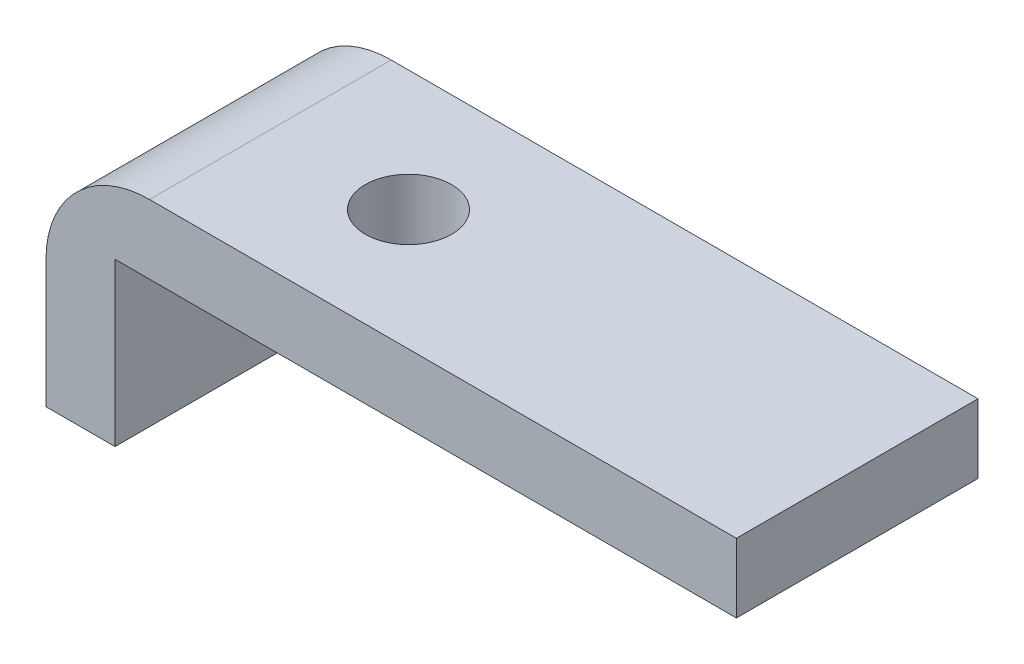
from build123d import *

# Parameters (mm, degrees)
EXTRUDE_1_DEPTH   = 3.5
HOLE_WIZARD_M31_D = 2.5


with BuildPart() as part:
    # Эскиз1 → Бобышка-Вытянуть1 (new, symmetric)
    with BuildSketch(Plane.XY):
        with BuildLine():
            Line((8.5, 0), (-8.5, 0))
            ThreePointArc((-8.5, 0), (-10.621320344, -0.878679656), (-11.5, -3))
            Line((-11.5, -3), (-11.5, -6.7))
            Line((-11.5, -6.7), (-9.5, -6.7))
            Line((-9.5, -6.7), (-9.5, -2))
            Line((-9.5, -2), (8.5, -2))
            Line((8.5, -2), (8.5, 0))
        make_face()
    extrude(amount=EXTRUDE_1_DEPTH, both=True)

    # Отверстие обработанное метчиком M31 (through all)
    with Locations(Plane(origin=(0, -2, 0), x_dir=(-1, 0, 0), z_dir=(0, -1, 0))):
        with Locations((4.5, 0)):
            Hole(HOLE_WIZARD_M31_D / 2)


solid = part.part
